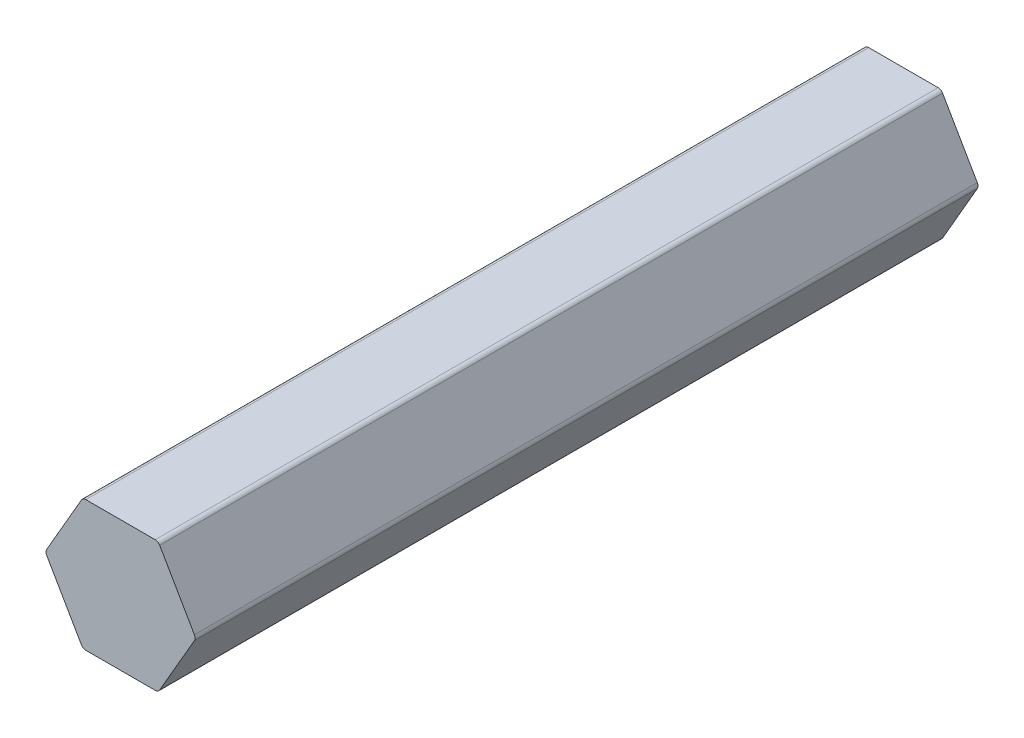
from build123d import *

# Parameters (mm, degrees)
BOSS_EXTRUDE1_DEPTH = 38.1
FILLET1_R           = 0.5


with BuildPart() as part:
    # Sketch1 → Boss-Extrude1 (new, symmetric)
    with BuildSketch(Plane.XY):
        Polygon((7.332348419, 0), (3.666174209, 6.35), (-3.666174209, 6.35), (-7.332348419, 0), (-3.666174209, -6.35), (3.666174209, -6.35), align=None)
    extrude(amount=BOSS_EXTRUDE1_DEPTH, both=True)

    # Fillet1
    fillet1_edges = [part.edges().sort_by_distance(p)[0] for p in [
        (3.666174209, -6.35, 0),
        (-3.666174209, -6.35, 0),
        (-7.332348419, 0, 0),
        (-3.666174209, 6.35, 0),
        (3.666174209, 6.35, 0),
        (7.332348419, 0, 0),
    ]]
    fillet(fillet1_edges, radius=FILLET1_R)


solid = part.part
